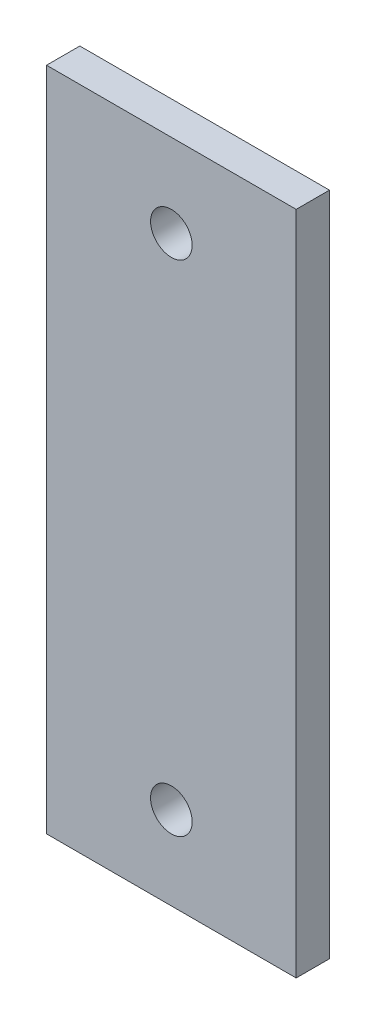
from build123d import *

# Parameters (mm, degrees)
ESQUISSE1_W        = 30
ESQUISSE1_H        = 80
ESQUISSE1_R        = 2.5
BOSS_EXTRU_1_DEPTH = 4


with BuildPart() as part:
    # Esquisse1 → Boss.-Extru.1 (new body)
    with BuildSketch(Plane.XY):
        Rectangle(ESQUISSE1_W, ESQUISSE1_H)
        with Locations((0, 30)):
            Circle(ESQUISSE1_R, mode=Mode.SUBTRACT)
        with Locations(Location((0, -30, 0), (0, 0, 180))):
            Circle(ESQUISSE1_R, mode=Mode.SUBTRACT)
    extrude(amount=BOSS_EXTRU_1_DEPTH)


solid = part.part
